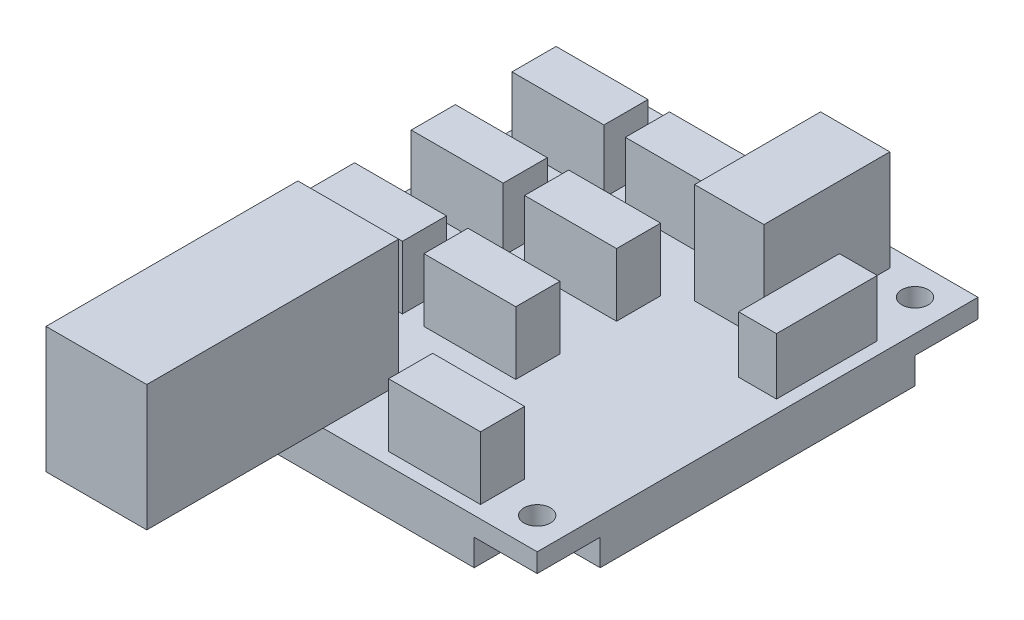
from build123d import *

# Parameters (mm, degrees)
SKETCH_1_W                       = 30
SKETCH_1_H                       = 35
EXTRUDE_1_DEPTH                  = 0.75
SKETCH_2_R                       = 1.05
CUT_EXTRUDE_1_DEPTH              = 1.5
EXTRUDE_2_DEPTH                  = 2.1
SKETCH_4_W                       = 7.3
SKETCH_4_H                       = 3.5
EXTRUDE_3_DEPTH                  = 5
SKETCH_5_W                       = 7.3
SKETCH_5_H                       = 3.5
EXTRUDE_4_DEPTH                  = 5
PATTERN_LINEAR_1_COUNT           = 2
PATTERN_LINEAR_1_PITCH           = 9
PATTERN_LINEAR_2_COUNT           = 3
PATTERN_LINEAR_2_PITCH           = 8
PATTERN_LINEAR_2_COPY_1_SKETCH_W = 7.3
PATTERN_LINEAR_2_COPY_1_SKETCH_H = 3.5
PATTERN_LINEAR_2_COPY_1_DEPTH    = 5
PATTERN_LINEAR_2_COPY_2_SKETCH_W = 7.3
PATTERN_LINEAR_2_COPY_2_SKETCH_H = 3.5
PATTERN_LINEAR_2_COPY_2_DEPTH    = 5
SKETCH_6_W                       = 3
SKETCH_6_H                       = 8
EXTRUDE_5_DEPTH                  = 4.5
SKETCH_7_W                       = 8
SKETCH_7_H                       = 20
EXTRUDE_6_DEPTH                  = 10
SKETCH_8_W                       = 5.5
SKETCH_8_H                       = 10
EXTRUDE_7_DEPTH                  = 8


with BuildPart() as part:
    # ｽｹｯﾁ1 → ﾎﾞｽ - 押し出し1 (new, symmetric)
    with BuildSketch(Plane(origin=(0, 0, 0), x_dir=(1, 0, 0), z_dir=(0, 1, 0))):
        Rectangle(SKETCH_1_W, SKETCH_1_H)
    extrude(amount=EXTRUDE_1_DEPTH, both=True)

    # ｽｹｯﾁ2 → ｶｯﾄ - 押し出し1 (cut)
    with BuildSketch(Plane.XZ.offset(0.75)):
        with Locations(Location((-12.5, 15, 0), (0, 0, 270))):
            Circle(SKETCH_2_R)
        with Locations(Location((-12.5, -15, 0), (0, 0, 270))):
            Circle(SKETCH_2_R)
        with Locations(Location((12.5, 15, 0), (0, 0, 270))):
            Circle(SKETCH_2_R)
        with Locations(Location((12.5, -15, 0), (0, 0, 270))):
            Circle(SKETCH_2_R)
    extrude(amount=-CUT_EXTRUDE_1_DEPTH, mode=Mode.SUBTRACT)

    # ｽｹｯﾁ3 → ﾎﾞｽ - 押し出し2 (add)
    with BuildSketch(Plane.XZ.offset(0.75)):
        Polygon((-10, 17.5), (-10, 13.5), (-15, 13.5), (-15, -12.5), (-10, -12.5), (-10, -17.5), (10, -17.5), (10, -12.5), (15, -12.5), (15, 12.5), (10, 12.5), (10, 17.5), align=None)
    extrude(amount=EXTRUDE_2_DEPTH)

    # ｽｹｯﾁ4 → ﾎﾞｽ - 押し出し3 (add)
    with BuildSketch(Plane(origin=(0, 0.75, 0), x_dir=(1, 0, 0), z_dir=(0, 1, 0))):
        with Locations((5.85, -14.75)):
            Rectangle(SKETCH_4_W, SKETCH_4_H)
    extrude(amount=EXTRUDE_3_DEPTH)

    # ｽｹｯﾁ5 → ﾎﾞｽ - 押し出し4 (add)
    with BuildSketch(Plane(origin=(0, 0.75, 0), x_dir=(1, 0, 0), z_dir=(0, 1, 0))):
        with Locations((-10.35, 11.25)):
            Rectangle(SKETCH_5_W, SKETCH_5_H)
    extrude_4 = extrude(amount=EXTRUDE_4_DEPTH)

    # 直線ﾊﾟﾀｰﾝ1: ﾎﾞｽ - 押し出し4 ×2
    with Locations(*[(i * PATTERN_LINEAR_1_PITCH, 0, 0) for i in range(1, PATTERN_LINEAR_1_COUNT)]):
        add(extrude_4)

    # 直線ﾊﾟﾀｰﾝ2: ﾎﾞｽ - 押し出し4 ×3
    with Locations(*[(0, 0, i * PATTERN_LINEAR_2_PITCH) for i in range(1, PATTERN_LINEAR_2_COUNT)]):
        add(extrude_4)

    # 直線ﾊﾟﾀｰﾝ2 copy 1 sketch → 直線ﾊﾟﾀｰﾝ2 copy 1 (add)
    with BuildSketch(Plane(origin=(9, 0.75, 8), x_dir=(1, 0, 0), z_dir=(0, 1, 0))):
        with Locations((-10.35, 11.25)):
            Rectangle(PATTERN_LINEAR_2_COPY_1_SKETCH_W, PATTERN_LINEAR_2_COPY_1_SKETCH_H)
    extrude(amount=PATTERN_LINEAR_2_COPY_1_DEPTH)

    # 直線ﾊﾟﾀｰﾝ2 copy 2 sketch → 直線ﾊﾟﾀｰﾝ2 copy 2 (add)
    with BuildSketch(Plane(origin=(9, 0.75, 16), x_dir=(1, 0, 0), z_dir=(0, 1, 0))):
        with Locations((-10.35, 11.25)):
            Rectangle(PATTERN_LINEAR_2_COPY_2_SKETCH_W, PATTERN_LINEAR_2_COPY_2_SKETCH_H)
    extrude(amount=PATTERN_LINEAR_2_COPY_2_DEPTH)

    # ｽｹｯﾁ6 → ﾎﾞｽ - 押し出し5 (add)
    with BuildSketch(Plane(origin=(0, 0.75, 0), x_dir=(1, 0, 0), z_dir=(0, 1, 0))):
        with Locations((12.5, 6.5)):
            Rectangle(SKETCH_6_W, SKETCH_6_H)
    extrude(amount=EXTRUDE_5_DEPTH)

    # ｽｹｯﾁ7 → ﾎﾞｽ - 押し出し6 (add)
    with BuildSketch(Plane(origin=(0, 0.75, 0), x_dir=(1, 0, 0), z_dir=(0, 1, 0))):
        with Locations((-6, -21.5)):
            Rectangle(SKETCH_7_W, SKETCH_7_H)
    extrude(amount=EXTRUDE_6_DEPTH)

    # ｽｹｯﾁ8 → ﾎﾞｽ - 押し出し7 (add)
    with BuildSketch(Plane(origin=(0, 0.75, 0), x_dir=(1, 0, 0), z_dir=(0, 1, 0))):
        with Locations((6.75, 11)):
            Rectangle(SKETCH_8_W, SKETCH_8_H)
    extrude(amount=EXTRUDE_7_DEPTH)


solid = part.part
